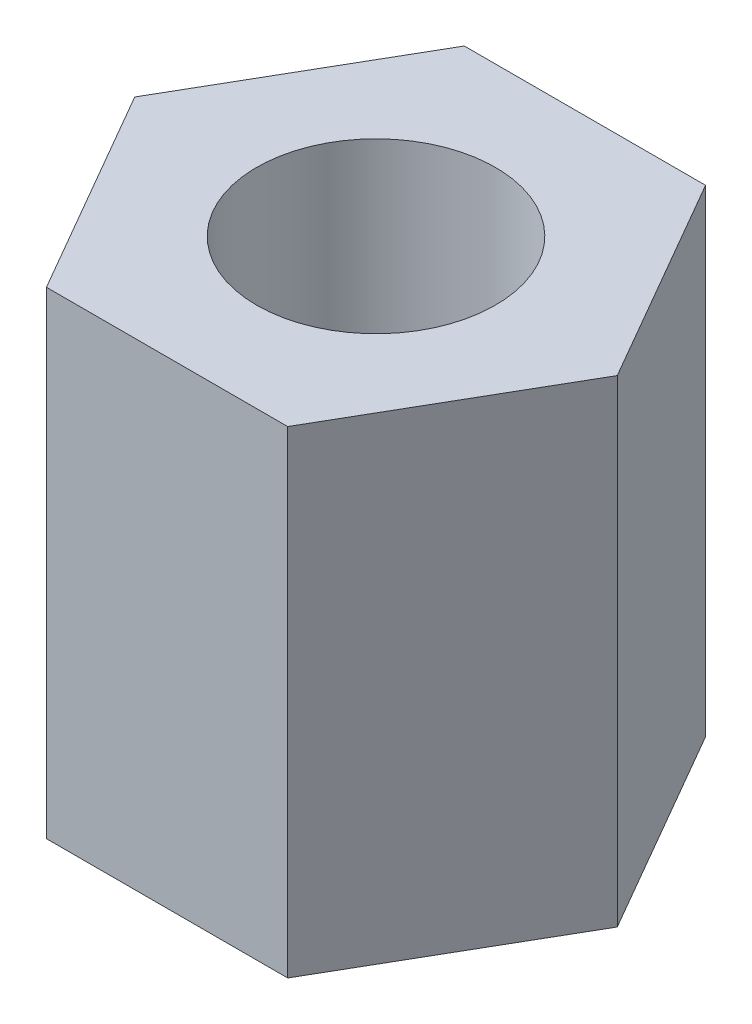
from build123d import *

# Parameters (mm, degrees)
SKETCH1_R           = 2
BOSS_EXTRUDE1_DEPTH = 8


with BuildPart() as part:
    # Sketch1 → Boss-Extrude1 (new body)
    with BuildSketch(Plane(origin=(0, 0, 0), x_dir=(1, 0, 0), z_dir=(0, 1, 0))):
        Polygon((4.041451884, 0), (2.020725942, 3.5), (-2.020725942, 3.5), (-4.041451884, 0), (-2.020725942, -3.5), (2.020725942, -3.5), align=None)
        with Locations(Location((0, 0, 0), (0, 0, 270))):
            Circle(SKETCH1_R, mode=Mode.SUBTRACT)
    extrude(amount=BOSS_EXTRUDE1_DEPTH)


solid = part.part
